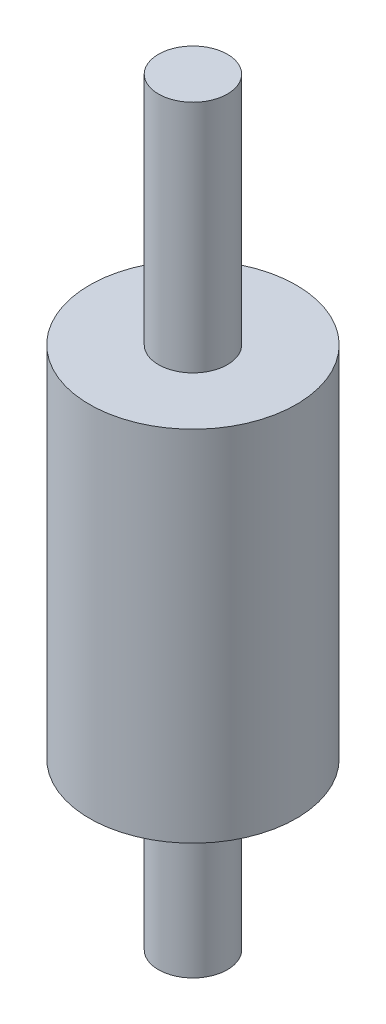
from build123d import *


with BuildPart() as part:
    # Sketch1 → Revolve1 (revolve)
    with BuildSketch(Plane(origin=(0, 0, 0), x_dir=(0, 0, -1), z_dir=(1, 0, 0))):
        Polygon((0, -27.5), (2.5, -27.5), (2.5, -15.5), (7.5, -15.5), (7.5, 10.5), (2.5, 10.5), (2.5, 27.5), (0, 27.5), align=None)
    revolve(axis=Axis((0, 0, 0), (0, 1, 0)))


solid = part.part
